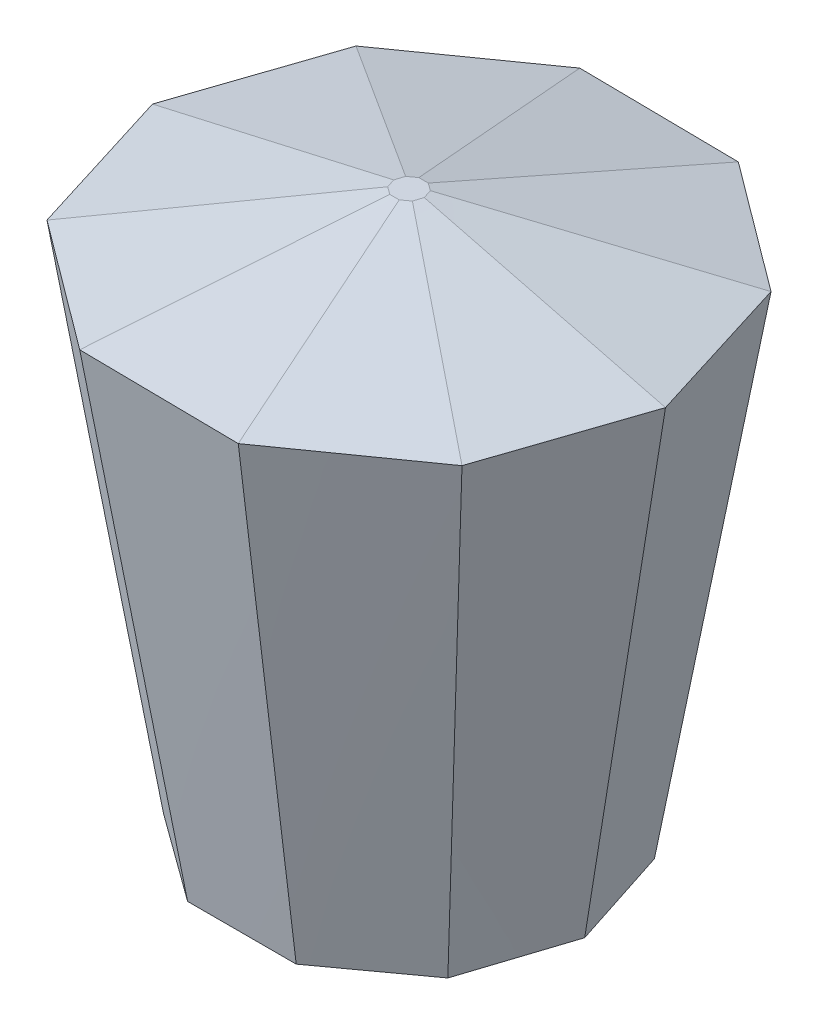
from build123d import *

# Parameters (mm, degrees)
CROQUIS5_R            = 1.5
CORTAR_EXTRUIR1_DEPTH = 19


with BuildPart() as part:
    # Croquis1 → Recubrir1 section 0
    with BuildSketch(Plane(origin=(0, 0, 0), x_dir=(1, 0, 0), z_dir=(0, 1, 0))):
        with BuildLine():
            Line((-6.045907789, 0), (-4.891242148, -3.553695435))
            Line((-4.891242148, -3.553695435), (-1.868288253, -5.75))
            Line((-1.868288253, -5.75), (1.868288253, -5.75))
            Line((1.868288253, -5.75), (4.891242148, -3.553695435))
            Line((4.891242148, -3.553695435), (6.045907789, 0))
            Line((6.045907789, 0), (4.891242148, 3.553695435))
            Line((4.891242148, 3.553695435), (1.868288253, 5.75))
            Line((1.868288253, 5.75), (-1.868288253, 5.75))
            Line((-1.868288253, 5.75), (-4.891242148, 3.553695435))
            Line((-4.891242148, 3.553695435), (-6.045907789, 0))
        make_face()
    # Croquis2 → Recubrir1 section 1
    with BuildSketch(Plane(origin=(0, 17.3, 0), x_dir=(1, 0, 0), z_dir=(0, 1, 0))):
        with BuildLine():
            Line((-8.936753451, 0.109878116), (-7.294570153, -5.163998619))
            Line((-7.294570153, -5.163998619), (-2.866108989, -8.465403399))
            Line((-2.866108989, -8.465403399), (2.657108393, -8.53331181))
            Line((2.657108393, -8.53331181), (7.16540068, -5.341785145))
            Line((7.16540068, -5.341785145), (8.936753451, -0.109878116))
            Line((8.936753451, -0.109878116), (7.294570153, 5.163998619))
            Line((7.294570153, 5.163998619), (2.866108989, 8.465403399))
            Line((2.866108989, 8.465403399), (-2.657108393, 8.53331181))
            Line((-2.657108393, 8.53331181), (-7.16540068, 5.341785145))
            Line((-7.16540068, 5.341785145), (-8.936753451, 0.109878116))
        make_face()
    loft()

    # Croquis4 → Recubrir2 section 0
    with BuildSketch(Plane(origin=(0, 19.3, 0), x_dir=(1, 0, 0), z_dir=(0, 1, 0))):
        with BuildLine():
            Line((-0.525731112, 0), (-0.425325404, -0.309016994))
            Line((-0.425325404, -0.309016994), (-0.162459848, -0.5))
            Line((-0.162459848, -0.5), (0.162459848, -0.5))
            Line((0.162459848, -0.5), (0.425325404, -0.309016994))
            Line((0.425325404, -0.309016994), (0.525731112, 0))
            Line((0.525731112, 0), (0.425325404, 0.309016994))
            Line((0.425325404, 0.309016994), (0.162459848, 0.5))
            Line((0.162459848, 0.5), (-0.162459848, 0.5))
            Line((-0.162459848, 0.5), (-0.425325404, 0.309016994))
            Line((-0.425325404, 0.309016994), (-0.525731112, 0))
        make_face()
    # Croquis2<3> → Recubrir2 section 1
    with BuildSketch(Plane(origin=(0, 17.3, 0), x_dir=(1, 0, 0), z_dir=(0, 1, 0))):
        with BuildLine():
            Line((-8.936753451, 0.109878116), (-7.294570153, -5.163998619))
            Line((-7.294570153, -5.163998619), (-2.866108989, -8.465403399))
            Line((-2.866108989, -8.465403399), (2.657108393, -8.53331181))
            Line((2.657108393, -8.53331181), (7.16540068, -5.341785145))
            Line((7.16540068, -5.341785145), (8.936753451, -0.109878116))
            Line((8.936753451, -0.109878116), (7.294570153, 5.163998619))
            Line((7.294570153, 5.163998619), (2.866108989, 8.465403399))
            Line((2.866108989, 8.465403399), (-2.657108393, 8.53331181))
            Line((-2.657108393, 8.53331181), (-7.16540068, 5.341785145))
            Line((-7.16540068, 5.341785145), (-8.936753451, 0.109878116))
        make_face()
    loft()

    # Croquis5 → Cortar-Extruir1 (cut)
    with BuildSketch(Plane.XZ):
        Circle(CROQUIS5_R)
    extrude(amount=-CORTAR_EXTRUIR1_DEPTH, mode=Mode.SUBTRACT)


solid = part.part
